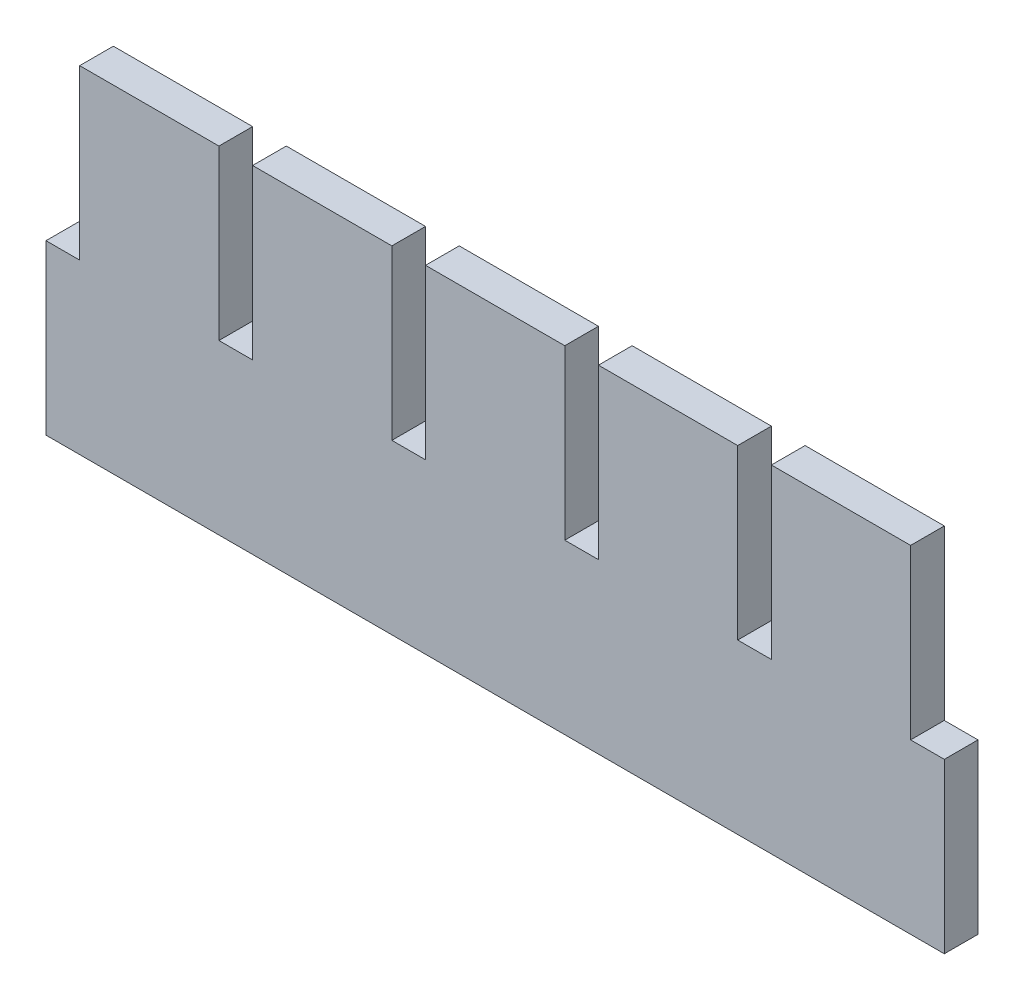
from build123d import *

# Parameters (mm, degrees)
BOSS_EXTRUDE1_DEPTH = 3


with BuildPart() as part:
    # Sketch1 → Boss-Extrude1 (new body)
    with BuildSketch(Plane.XY):
        Polygon((0, 0), (80, 0), (80, 15), (77, 15), (77, 30), (64.6, 30), (64.6, 15), (61.6, 15), (61.6, 30), (49.2, 30), (49.2, 15), (46.2, 15), (46.2, 30), (33.8, 30), (33.8, 15), (30.8, 15), (30.8, 30), (18.4, 30), (18.4, 15), (15.4, 15), (15.4, 30), (3, 30), (3, 15), (0, 15), align=None)
    extrude(amount=BOSS_EXTRUDE1_DEPTH)


solid = part.part
